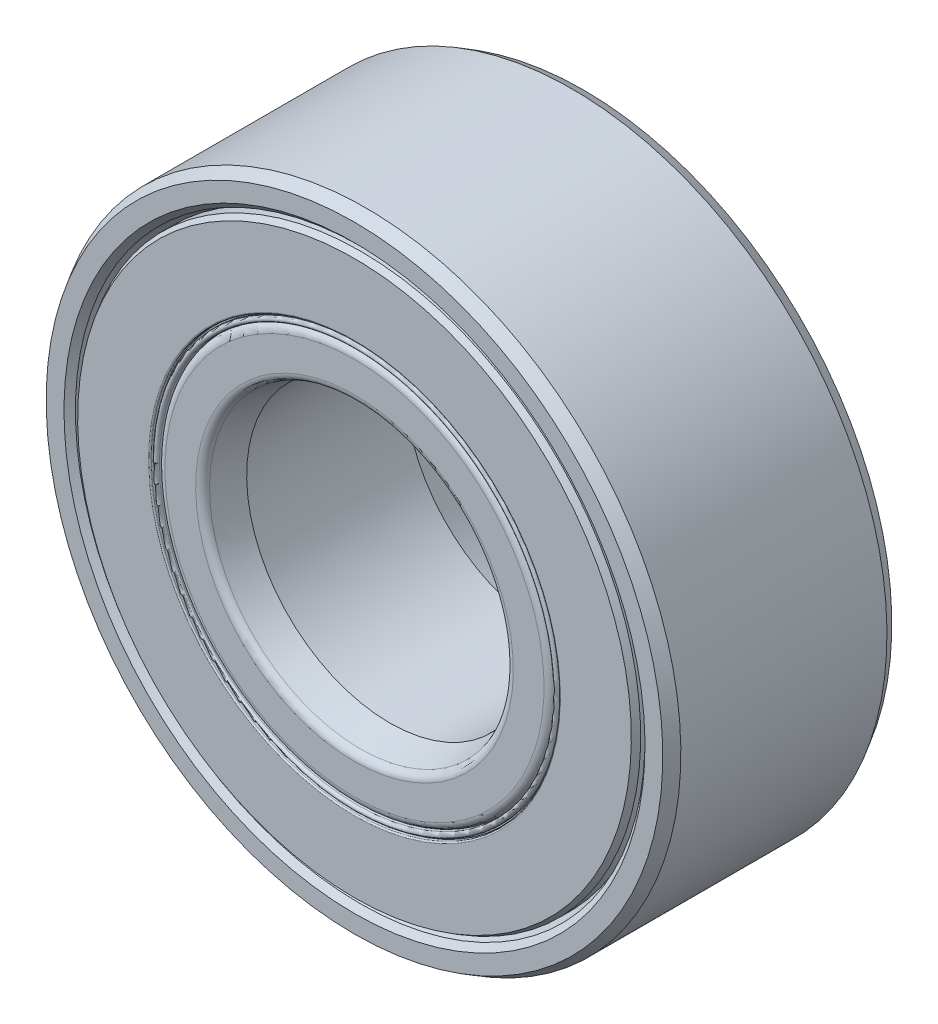
from build123d import *

# Parameters (mm, degrees)
CIRPATTERN1_COUNT = 9


with BuildPart() as part:
    # Sketch3 → Revolve1 (revolve)
    with BuildSketch(Plane(origin=(0, 0, 0), x_dir=(0, 0, -1), z_dir=(1, 0, 0)), mode=Mode.PRIVATE) as revolve1_sk:
        with BuildLine():
            Line((-1.682987285, 4.895), (-1.9, 4.973986169))
            Line((-1.9, 4.973986169), (-2, 5.073986169))
            Line((-2, 5.073986169), (-2, 5.384529946))
            Line((-2, 5.384529946), (-1.8, 5.5))
            Line((-1.8, 5.5), (1.8, 5.5))
            Line((1.8, 5.5), (2, 5.384529946))
            Line((2, 5.384529946), (2, 5.073986169))
            Line((2, 5.073986169), (1.9, 4.973986169))
            Line((1.9, 4.973986169), (1.682987285, 4.895))
            Line((1.682987285, 4.895), (0.863030835, 4.895))
            ThreePointArc((0.863030835, 4.895), (0, 5.298333333), (-0.863030835, 4.895))
            Line((-0.863030835, 4.895), (-1.682987285, 4.895))
        make_face()
    revolve(revolve1_sk.sketch.rotate(Axis((0, 0, 2), (0, 0, -1)), 180), axis=Axis((0, 0, 2), (0, 0, -1)))


with BuildPart() as body_2:
    # Sketch4 → Revolve2 (revolve)
    with BuildSketch(Plane(origin=(0, 0, 0), x_dir=(0, 0, -1), z_dir=(1, 0, 0)), mode=Mode.PRIVATE) as revolve2_sk:
        with BuildLine():
            Line((-1.383210294, 2.5), (-1.894812259, 2.637083333))
            ThreePointArc((-1.894812259, 2.637083333), (-1.97067289, 2.687771787), (-2, 2.774166667))
            Line((-2, 2.774166667), (-2, 3.309747557))
            ThreePointArc((-2, 3.309747557), (-1.958432855, 3.410099522), (-1.85808089, 3.451666667))
            Line((-1.85808089, 3.451666667), (-0.863030835, 3.451666667))
            ThreePointArc((-0.863030835, 3.451666667), (0, 3.048333333), (0.863030835, 3.451666667))
            Line((0.863030835, 3.451666667), (1.85808089, 3.451666667))
            ThreePointArc((1.85808089, 3.451666667), (1.958432855, 3.410099522), (2, 3.309747557))
            Line((2, 3.309747557), (2, 2.774166667))
            ThreePointArc((2, 2.774166667), (1.97067289, 2.687771787), (1.894812259, 2.637083333))
            Line((1.894812259, 2.637083333), (1.383210294, 2.5))
            Line((1.383210294, 2.5), (-1.383210294, 2.5))
        make_face()
    revolve(revolve2_sk.sketch.rotate(Axis((0, 0, 2), (0, 0, -1)), 180), axis=Axis((0, 0, 2), (0, 0, -1)))


with BuildPart() as body_3:
    # Sketch5 → Revolve3 (revolve)
    with BuildSketch(Plane(origin=(0, 0, 0), x_dir=(0, 0, -1), z_dir=(1, 0, 0))):
        with BuildLine():
            Line((-1.125, 4.173333333), (1.125, 4.173333333))
            ThreePointArc((1.125, 4.173333333), (0, 5.298333333), (-1.125, 4.173333333))
        make_face()
    revolve(axis=Axis((0, 4.173333333, 1.125), (0, 0, -1)))


with BuildPart() as cirpattern1_1:
    # CirPattern1: pattern copy
    add(body_3.part.rotate(Axis((0, 0, 0), (0, 0, 1)), 1 * 360 / CIRPATTERN1_COUNT))


with BuildPart() as cirpattern1_2:
    # CirPattern1: pattern copy
    add(body_3.part.rotate(Axis((0, 0, 0), (0, 0, 1)), 2 * 360 / CIRPATTERN1_COUNT))


with BuildPart() as cirpattern1_3:
    # CirPattern1: pattern copy
    add(body_3.part.rotate(Axis((0, 0, 0), (0, 0, 1)), 3 * 360 / CIRPATTERN1_COUNT))


with BuildPart() as cirpattern1_4:
    # CirPattern1: pattern copy
    add(body_3.part.rotate(Axis((0, 0, 0), (0, 0, 1)), 4 * 360 / CIRPATTERN1_COUNT))


with BuildPart() as cirpattern1_5:
    # CirPattern1: pattern copy
    add(body_3.part.rotate(Axis((0, 0, 0), (0, 0, 1)), 5 * 360 / CIRPATTERN1_COUNT))


with BuildPart() as cirpattern1_6:
    # CirPattern1: pattern copy
    add(body_3.part.rotate(Axis((0, 0, 0), (0, 0, 1)), 6 * 360 / CIRPATTERN1_COUNT))


with BuildPart() as cirpattern1_7:
    # CirPattern1: pattern copy
    add(body_3.part.rotate(Axis((0, 0, 0), (0, 0, 1)), 7 * 360 / CIRPATTERN1_COUNT))


with BuildPart() as cirpattern1_8:
    # CirPattern1: pattern copy
    add(body_3.part.rotate(Axis((0, 0, 0), (0, 0, 1)), 8 * 360 / CIRPATTERN1_COUNT))


with BuildPart() as body_12:
    # Sketch6 → Revolve4 (revolve)
    with BuildSketch(Plane(origin=(0, 0, 0), x_dir=(0, 0, -1), z_dir=(1, 0, 0)), mode=Mode.PRIVATE) as revolve4_sk:
        with BuildLine():
            Line((-1.896076952, 4.895), (-1.125, 4.895))
            Line((-1.125, 4.895), (-1.125, 3.571666667))
            Line((-1.125, 3.571666667), (-1.976, 3.571666667))
            ThreePointArc((-1.976, 3.571666667), (-1.992970563, 3.578696104), (-2, 3.595666667))
            Line((-2, 3.595666667), (-2, 4.835))
            Line((-2, 4.835), (-1.896076952, 4.895))
        make_face()
        with BuildLine():
            Line((1.976, 3.571666667), (1.125, 3.571666667))
            Line((1.125, 3.571666667), (1.125, 4.895))
            Line((1.125, 4.895), (1.896076952, 4.895))
            Line((1.896076952, 4.895), (2, 4.835))
            Line((2, 4.835), (2, 3.595666667))
            ThreePointArc((2, 3.595666667), (1.992970563, 3.578696104), (1.976, 3.571666667))
        make_face()
    revolve(revolve4_sk.sketch.rotate(Axis((0, 0, 2), (0, 0, -1)), 180), axis=Axis((0, 0, 2), (0, 0, -1)))


with BuildPart() as body_13:
    # Sketch7 → Revolve5 (revolve)
    with BuildSketch(Plane(origin=(0, 0, 0), x_dir=(0, 0, -1), z_dir=(1, 0, 0)), mode=Mode.PRIVATE) as revolve5_sk:
        with BuildLine():
            Line((-1.125, 3.571666667), (-1.90262466, 3.571666667))
            Line((-1.90262466, 3.571666667), (-1.932168892, 3.566457221))
            ThreePointArc((-1.932168892, 3.566457221), (-1.942442625, 3.553068232), (-1.93, 3.541666667))
            Line((-1.93, 3.541666667), (-1.955, 3.541666667))
            ThreePointArc((-1.955, 3.541666667), (-2, 3.496666667), (-1.955, 3.451666667))
            Line((-1.955, 3.451666667), (-1.125, 3.451666667))
            Line((-1.125, 3.451666667), (-1.125, 3.571666667))
        make_face()
    revolve(revolve5_sk.sketch.rotate(Axis((0, 0, 2), (0, 0, -1)), 180), axis=Axis((0, 0, 2), (0, 0, -1)))


solid = Compound([part.part, body_2.part, body_3.part, cirpattern1_1.part, cirpattern1_2.part, cirpattern1_3.part, cirpattern1_4.part, cirpattern1_5.part, cirpattern1_6.part, cirpattern1_7.part, cirpattern1_8.part, body_12.part, body_13.part])
